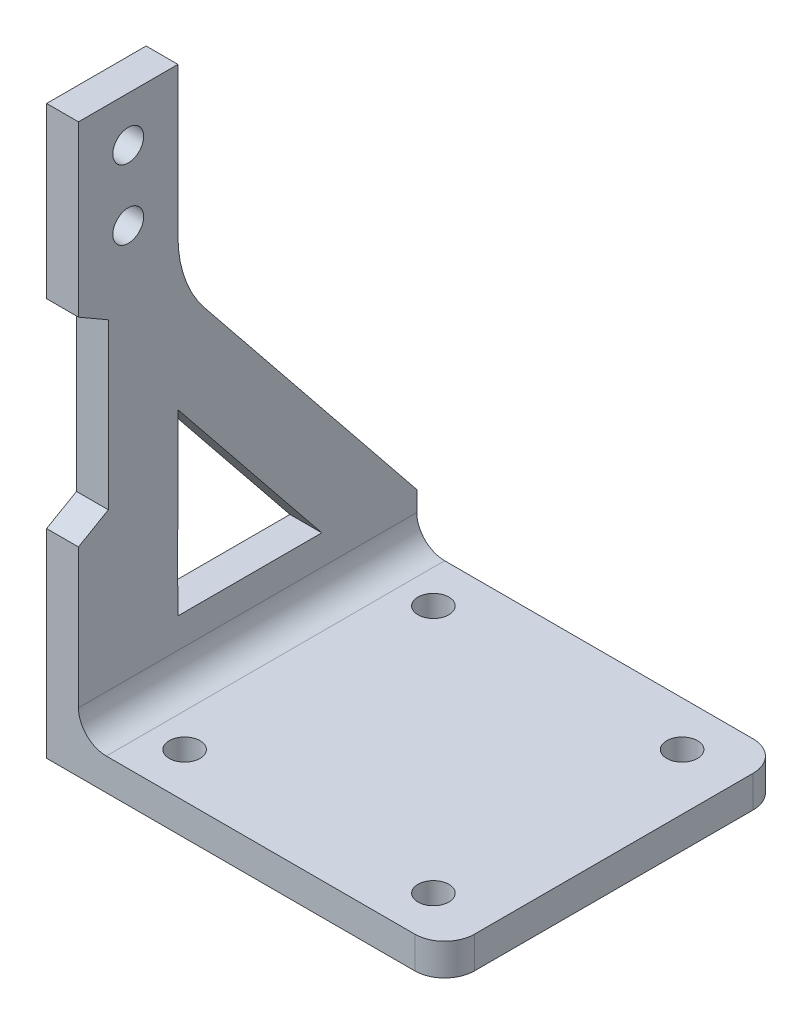
from build123d import *

# Parameters (mm, degrees)
BOSS_EXTRUDE1_DEPTH      = 17
BOSS_EXTRUDE1_DEPTH_BACK = 17
FILLET1_R                = 2.8
SKETCH4_R                = 1.5
CUT_EXTRUDE2_DEPTH       = 20
CUT_EXTRUDE3_REACH       = 73.68
SKETCH5_R                = 1.55
CUT_EXTRUDE4_DEPTH       = 72.67984375
CUT_EXTRUDE4_DEPTH_BACK  = 4
FILLET3_R                = 3
CUT_EXTRUDE5_DEPTH       = 5
SKETCH8_R                = 1.55
CUT_EXTRUDE8_DEPTH       = 10
CORTAR_EXTRUIR1_REACH    = 73.68
REDONDEO1_R              = 12


with BuildPart() as part:
    # Sketch1 → Boss-Extrude1 (new, two sides: drawn at the far end of the back side and taken through both)
    with BuildSketch(Plane.XY.offset(-BOSS_EXTRUDE1_DEPTH_BACK)):
        Polygon((0, 0), (0, 57), (3.2, 57), (3.2, 3.2), (40, 3.2), (40, 0), align=None)
    extrude(amount=BOSS_EXTRUDE1_DEPTH + BOSS_EXTRUDE1_DEPTH_BACK)

    # Fillet1
    fillet1_edges = [part.edges().sort_by_distance(p)[0] for p in [
        (3.2, 3.2, 0),
    ]]
    fillet(fillet1_edges, radius=FILLET1_R)

    # Sketch4 → Cut-Extrude2 (cut)
    with BuildSketch(Plane.XZ):
        with Locations((9.37, -12.5)):
            Circle(SKETCH4_R)
        with Locations((9.37, 12.5)):
            Circle(SKETCH4_R)
        with Locations((34.37, -12.5)):
            Circle(SKETCH4_R)
        with Locations((34.37, 12.5)):
            Circle(SKETCH4_R)
    extrude(amount=-CUT_EXTRUDE2_DEPTH, mode=Mode.SUBTRACT)

    # Sketch5 → Cut-Extrude3 (cut, up to next)
    with BuildSketch(Plane.XZ, mode=Mode.PRIVATE) as cut_extrude3_sk1:
        with Locations((9.37, 12.5)):
            Circle(SKETCH5_R)
    cut_extrude3_tool1 = extrude(cut_extrude3_sk1.sketch, amount=-CUT_EXTRUDE3_REACH, mode=Mode.PRIVATE) & part.part
    # Sketch5 → Cut-Extrude3 (cut, up to next)
    with BuildSketch(Plane.XZ, mode=Mode.PRIVATE) as cut_extrude3_sk2:
        with Locations((34.37, 12.5)):
            Circle(SKETCH5_R)
    cut_extrude3_tool2 = extrude(cut_extrude3_sk2.sketch, amount=-CUT_EXTRUDE3_REACH, mode=Mode.PRIVATE) & part.part
    # Sketch5 → Cut-Extrude3 (cut, up to next)
    with BuildSketch(Plane.XZ, mode=Mode.PRIVATE) as cut_extrude3_sk3:
        with Locations((9.37, -12.5)):
            Circle(SKETCH5_R)
    cut_extrude3_tool3 = extrude(cut_extrude3_sk3.sketch, amount=-CUT_EXTRUDE3_REACH, mode=Mode.PRIVATE) & part.part
    # Sketch5 → Cut-Extrude3 (cut, up to next)
    with BuildSketch(Plane.XZ, mode=Mode.PRIVATE) as cut_extrude3_sk4:
        with Locations((34.37, -12.5)):
            Circle(SKETCH5_R)
    cut_extrude3_tool4 = extrude(cut_extrude3_sk4.sketch, amount=-CUT_EXTRUDE3_REACH, mode=Mode.PRIVATE) & part.part
    add(cut_extrude3_tool1.solids().sort_by_distance((9.37, 0, 12.5))[0], mode=Mode.SUBTRACT)
    add(cut_extrude3_tool2.solids().sort_by_distance((34.37, 0, 12.5))[0], mode=Mode.SUBTRACT)
    add(cut_extrude3_tool3.solids().sort_by_distance((9.37, 0, -12.5))[0], mode=Mode.SUBTRACT)
    add(cut_extrude3_tool4.solids().sort_by_distance((34.37, 0, -12.5))[0], mode=Mode.SUBTRACT)

    # Sketch6 → Cut-Extrude4 (cut, two sides: drawn at the far end of the back side and taken through both)
    with BuildSketch(Plane.ZY.offset(-CUT_EXTRUDE4_DEPTH_BACK)):
        Polygon((7, 57), (-17, 57), (-17, 8), (7, 37.8), align=None)
    extrude(amount=CUT_EXTRUDE4_DEPTH + CUT_EXTRUDE4_DEPTH_BACK, mode=Mode.SUBTRACT)

    # Fillet3
    fillet3_edges = [part.edges().sort_by_distance(p)[0] for p in [
        (40, 1.6, -17),
        (40, 1.6, 17),
    ]]
    fillet(fillet3_edges, radius=FILLET3_R)

    # Sketch7 → Cut-Extrude5 (cut)
    with BuildSketch(Plane.ZY):
        Polygon((-7.454709153, 9), (7, 9), (7.028471746, 12.409902656), (7.004699048, 26.953765183), align=None)
    extrude(amount=-CUT_EXTRUDE5_DEPTH, mode=Mode.SUBTRACT)

    # Sketch8 → Cut-Extrude8 (cut)
    with BuildSketch(Plane.ZY):
        with Locations((12, 52.47)):
            Circle(SKETCH8_R)
        with Locations((12, 45.47)):
            Circle(SKETCH8_R)
    extrude(amount=-CUT_EXTRUDE8_DEPTH, mode=Mode.SUBTRACT)

    # Croquis1 → Cortar-Extruir1 (cut, up to next)
    with BuildSketch(Plane.ZY, mode=Mode.PRIVATE) as cortar_extruir1_sk1:
        Polygon((17, 20), (14, 21.732050808), (14, 38.267949192), (17, 40), align=None)
    cortar_extruir1_tool1 = extrude(cortar_extruir1_sk1.sketch, amount=-CORTAR_EXTRUIR1_REACH, mode=Mode.PRIVATE) & part.part
    add(cortar_extruir1_tool1.solids().sort_by_distance((0, 30, 15.547407))[0], mode=Mode.SUBTRACT)

    # Redondeo1
    redondeo1_edges = [part.edges().sort_by_distance(p)[0] for p in [
        (1.6, 37.8, 7),
    ]]
    fillet(redondeo1_edges, radius=REDONDEO1_R)


solid = part.part
